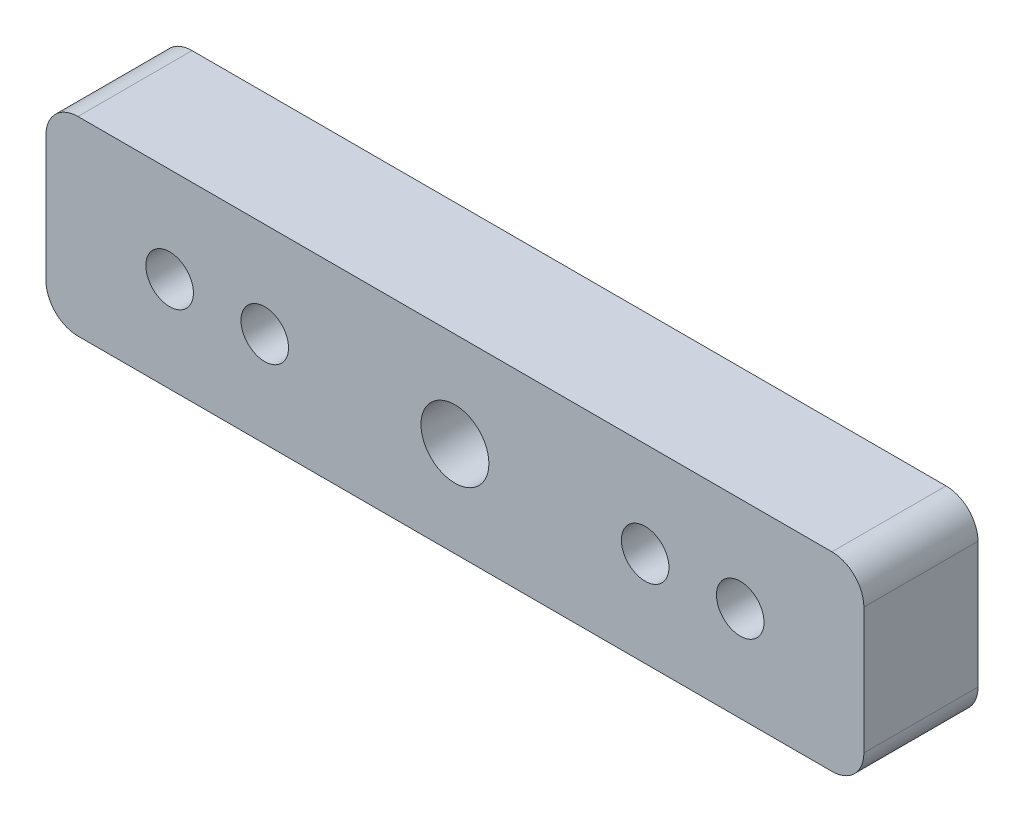
from build123d import *

# Parameters (mm, degrees)
SKETCH1_R           = 2.5
SKETCH1_R_2         = 3.57
BOSS_EXTRUDE1_DEPTH = 6


with BuildPart() as part:
    # Sketch1 → Boss-Extrude1 (new, symmetric)
    with BuildSketch(Plane.XY):
        with BuildLine():
            Line((-39.64, -10), (39.64, -10))
            ThreePointArc((39.64, -10), (42.015878785, -9.015878785), (43, -6.64))
            Line((43, -6.64), (43, 6.64))
            ThreePointArc((43, 6.64), (42.015878785, 9.015878785), (39.64, 10))
            Line((39.64, 10), (-39.64, 10))
            ThreePointArc((-39.64, 10), (-42.015878785, 9.015878785), (-43, 6.64))
            Line((-43, 6.64), (-43, -6.64))
            ThreePointArc((-43, -6.64), (-42.015878785, -9.015878785), (-39.64, -10))
        make_face()
        with Locations((-30, 0)):
            Circle(SKETCH1_R, mode=Mode.SUBTRACT)
        Circle(SKETCH1_R_2, mode=Mode.SUBTRACT)
        with Locations((30, 0)):
            Circle(SKETCH1_R, mode=Mode.SUBTRACT)
        with Locations((-20, 0)):
            Circle(SKETCH1_R, mode=Mode.SUBTRACT)
        with Locations((20, 0)):
            Circle(SKETCH1_R, mode=Mode.SUBTRACT)
    extrude(amount=BOSS_EXTRUDE1_DEPTH, both=True)


solid = part.part
